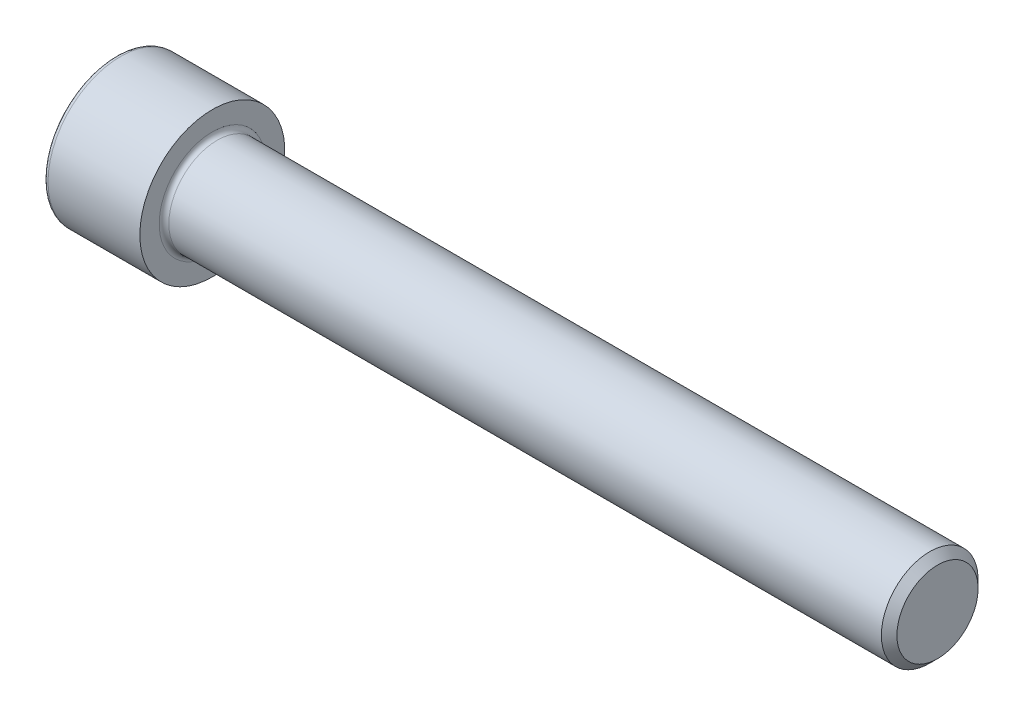
from build123d import *

# Parameters (mm, degrees)
FILLET1_R   = 0.6
FILLET2_R   = 0.6
HEX_2_DEPTH = 6


with BuildPart() as part:
    # BodySke → Base-Revolve (revolve)
    with BuildSketch(Plane.XY, mode=Mode.PRIVATE) as base_revolve_sk:
        Polygon((0, 0), (0, 9), (12, 9), (12, 6), (101.036, 6), (102, 5.036), (102, 0), align=None)
    revolve(base_revolve_sk.sketch.rotate(Axis((-31.75, 0, 0), (1, 0, 0)), 90), axis=Axis((-31.75, 0, 0), (1, 0, 0)))

    # Fillet1
    fillet1_edges = [part.edges().sort_by_distance(p)[0] for p in [
        (12, 0, -6),
    ]]
    fillet(fillet1_edges, radius=FILLET1_R)

    # Fillet2
    fillet2_edges = [part.edges().sort_by_distance(p)[0] for p in [
        (0, 0, -9),
    ]]
    fillet(fillet2_edges, radius=FILLET2_R)

    # Sketch2 → Hex-PreBroach (revolve, cut)
    with BuildSketch(Plane.XY, mode=Mode.PRIVATE) as hex_prebroach_sk:
        Polygon((0, 5.0575), (6, 5.0575), (8.919948986, 0), (0, 0), align=None)
    revolve(hex_prebroach_sk.sketch.rotate(Axis((0, 0, 0), (1, 0, 0)), 90), axis=Axis((0, 0, 0), (1, 0, 0)), mode=Mode.SUBTRACT)

    # Sketch3 → Hex 2 (cut)
    with BuildSketch(Plane(origin=(0, 0, 0), x_dir=(0, 0.500000000000001, 0.866025403784438), z_dir=(-1, 0, 0))):
        Polygon((2.919948986, 5.0575), (-2.919948986, 5.0575), (-5.839897973, 0), (-2.919948986, -5.0575), (2.919948986, -5.0575), (5.839897973, 0), align=None)
    extrude(amount=-HEX_2_DEPTH, mode=Mode.SUBTRACT)


solid = part.part
